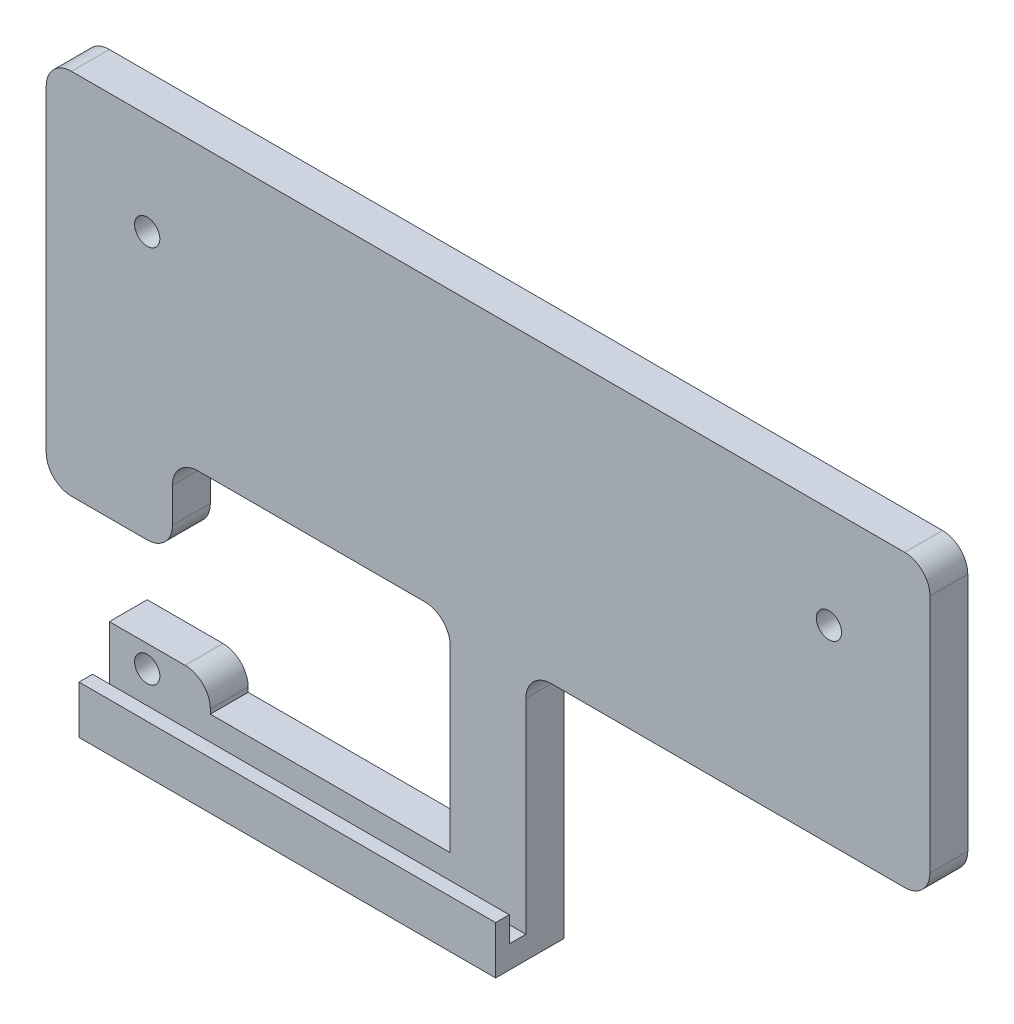
from build123d import *

# Parameters (mm, degrees)
BOSS_EXTRUDE1_DEPTH     = 3.81
SKETCH3_W               = 41.91
SKETCH3_H               = 2.286
BOSS_EXTRUDE2_DEPTH     = 3.048
SKETCH4_W               = 41.91
SKETCH4_H               = 1.3716
BOSS_EXTRUDE3_DEPTH     = 2.54
CUT_EXTRUDE1_DEPTH      = 54.324878809
CUT_EXTRUDE1_DEPTH_BACK = 54.324878809
SKETCH5_R               = 1.27


with BuildPart() as part:
    # Sketch2 → Boss-Extrude1 (new body)
    with BuildSketch(Plane(origin=(0, 0, -1.651), x_dir=(-1, 0, 0), z_dir=(0, 0, -1))):
        with BuildLine():
            Line((-44.45, 26.67), (-44.45, 5.378493099))
            Line((-44.45, 5.378493099), (-44.45, 2.54))
            ThreePointArc((-44.45, 2.54), (-43.706051224, 0.743948776), (-41.91, 0))
            Line((-41.91, 0), (-6.35, 0))
            ThreePointArc((-6.35, 0), (-4.553948776, -0.743948776), (-3.81, -2.54))
            Line((-3.81, -2.54), (-3.81, -22.86))
            Line((-3.81, -22.86), (-3.81, -25.4))
            Line((-3.81, -25.4), (38.1, -25.4))
            Line((38.1, -25.4), (38.1, -22.86))
            Line((38.1, -22.86), (38.1, -16.8275))
            Line((38.1, -16.8275), (30.48, -16.8275))
            ThreePointArc((30.48, -16.8275), (28.683948776, -17.571448776), (27.94, -19.3675))
            Line((27.94, -19.3675), (27.94, -19.812))
            Line((27.94, -19.812), (3.81, -19.812))
            Line((3.81, -19.812), (3.81, -1.778))
            ThreePointArc((3.81, -1.778), (4.553948776, 0.018051224), (6.35, 0.762))
            Line((6.35, 0.762), (29.21, 0.762))
            ThreePointArc((29.21, 0.762), (31.006051224, 0.018051224), (31.75, -1.778))
            Line((31.75, -1.778), (31.75, -5.2705))
            ThreePointArc((31.75, -5.2705), (32.493948776, -7.066551224), (34.29, -7.8105))
            Line((34.29, -7.8105), (41.91, -7.8105))
            ThreePointArc((41.91, -7.8105), (43.706051224, -7.066551224), (44.45, -5.2705))
            Line((44.45, -5.2705), (44.45, 26.67))
            ThreePointArc((44.45, 26.67), (43.706051224, 28.466051224), (41.91, 29.21))
            Line((41.91, 29.21), (-41.91, 29.21))
            ThreePointArc((-41.91, 29.21), (-43.706051224, 28.466051224), (-44.45, 26.67))
        make_face()
    extrude(amount=BOSS_EXTRUDE1_DEPTH)

    # Sketch3 → Boss-Extrude2 (add)
    with BuildSketch(Plane.XY.offset(-1.651)):
        with Locations((-17.145, -24.257)):
            Rectangle(SKETCH3_W, SKETCH3_H)
    extrude(amount=BOSS_EXTRUDE2_DEPTH)

    # Sketch4 → Boss-Extrude3 (add)
    with BuildSketch(Plane(origin=(0, -23.114, 0), x_dir=(1, 0, 0), z_dir=(0, 1, 0))):
        with Locations((-17.145, -0.7112)):
            Rectangle(SKETCH4_W, SKETCH4_H)
    extrude(amount=BOSS_EXTRUDE3_DEPTH)

    # Sketch5 → Cut-Extrude1 (cut, two sides: drawn at the far end of the back side and taken through both)
    with BuildSketch(Plane.XY.offset(-1.651).offset(-CUT_EXTRUDE1_DEPTH_BACK)):
        with Locations((-34.29, 19.05)):
            Circle(SKETCH5_R)
        with Locations((34.29, 19.05)):
            Circle(SKETCH5_R)
        with Locations((-34.29, -19.05)):
            Circle(SKETCH5_R)
    extrude(amount=CUT_EXTRUDE1_DEPTH + CUT_EXTRUDE1_DEPTH_BACK, mode=Mode.SUBTRACT)


solid = part.part
